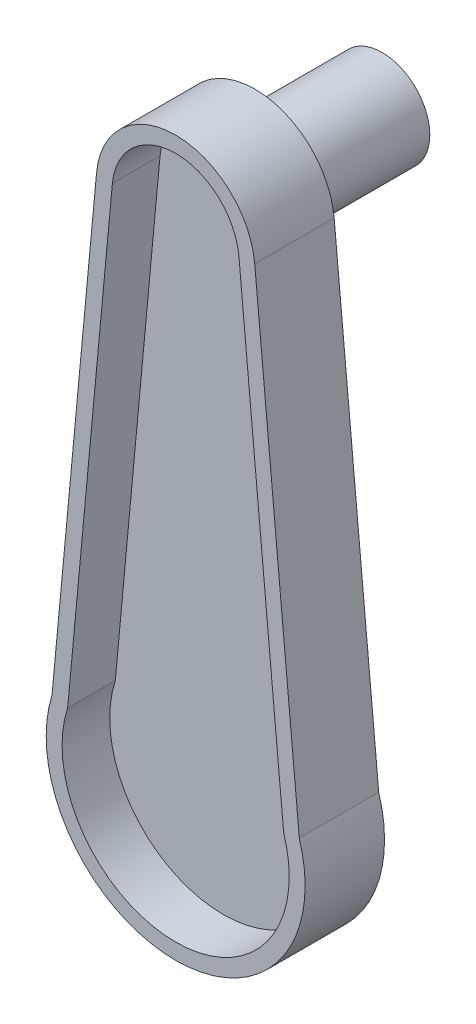
from build123d import *

# Parameters (mm, degrees)
BOSS_EXTRUDE1_DEPTH = 1
EXTRUDE_THIN1_DEPTH = 2.5
SKETCH2_R           = 1.5
BOSS_EXTRUDE2_DEPTH = 4


with BuildPart() as part:
    # Sketch1 → Boss-Extrude1 (new body)
    with BuildSketch(Plane.XY):
        with BuildLine():
            Line((-3.4, 1.10481899), (-1.99124577, 16.111923197))
            ThreePointArc((-1.99124577, 16.111923197), (0, 17.925), (1.99124577, 16.111923197))
            Line((1.99124577, 16.111923197), (3.4, 1.10481899))
            ThreePointArc((3.4, 1.10481899), (0, -3.575), (-3.4, 1.10481899))
        make_face()
    extrude(amount=BOSS_EXTRUDE1_DEPTH)

    # Sketch1<3> → Extrude-Thin1 (add)
    with BuildSketch(Plane.XY):
        with BuildLine():
            Line((-3.892807616, 1.204854291), (-2.489057213, 16.158653997))
            ThreePointArc((-2.489057213, 16.158653997), (0, 18.425), (2.489057213, 16.158653997))
            Line((2.489057213, 16.158653997), (3.892807616, 1.204854291))
            ThreePointArc((3.892807616, 1.204854291), (0, -4.075), (-3.892807616, 1.204854291))
        make_face()
        with BuildLine():
            Line((-3.4, 1.10481899), (-1.99124577, 16.111923197))
            ThreePointArc((-1.99124577, 16.111923197), (0, 17.925), (1.99124577, 16.111923197))
            Line((1.99124577, 16.111923197), (3.4, 1.10481899))
            ThreePointArc((3.4, 1.10481899), (0, -3.575), (-3.4, 1.10481899))
        make_face(mode=Mode.SUBTRACT)
    extrude(amount=EXTRUDE_THIN1_DEPTH)

    # Sketch2 → Boss-Extrude2 (add)
    with BuildSketch(Plane(origin=(0, 0, 0), x_dir=(-1, 0, 0), z_dir=(0, 0, -1))):
        with Locations((0, 15.925)):
            Circle(SKETCH2_R)
    extrude(amount=BOSS_EXTRUDE2_DEPTH)


solid = part.part
